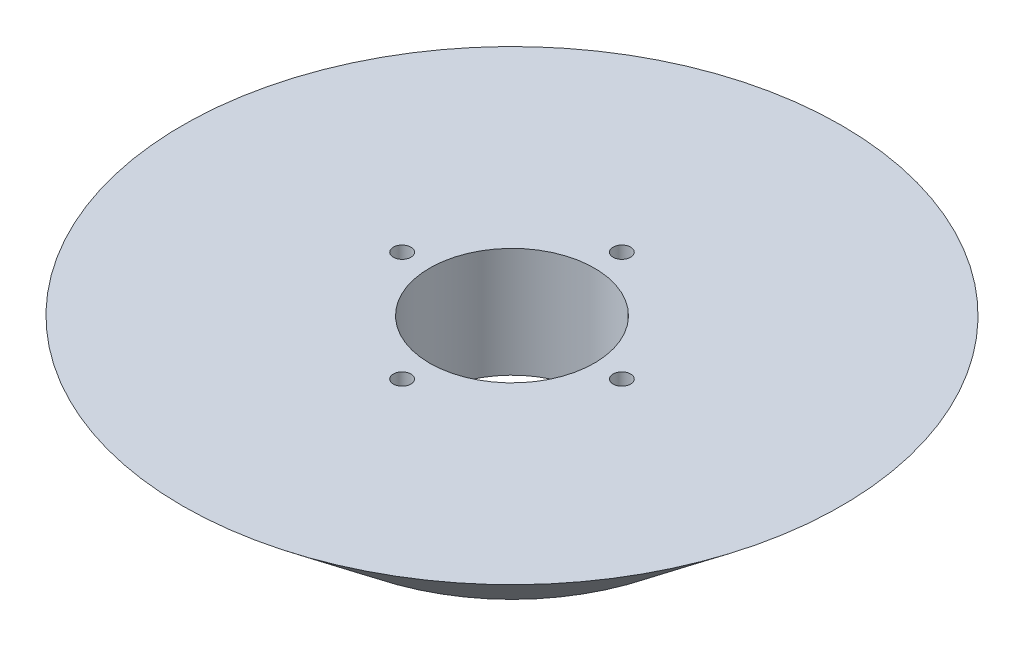
from build123d import *

# Parameters (mm, degrees)
SKETCH_2_R          = 60
SKETCH_1_R          = 35
SKETCH_3_R          = 1.6
SKETCH_3_R_2        = 15
CUT_EXTRUDE_1_DEPTH = 88.177979031


with BuildPart() as part:
    # ｽｹｯﾁ2 → ﾛﾌﾄ1 section 0
    with BuildSketch(Plane(origin=(0, 20, 0), x_dir=(1, 0, 0), z_dir=(0, 1, 0))):
        Circle(SKETCH_2_R)
    # ｽｹｯﾁ1 → ﾛﾌﾄ1 section 1
    with BuildSketch(Plane(origin=(0, 0, 0), x_dir=(1, 0, 0), z_dir=(0, 1, 0))):
        Circle(SKETCH_1_R)
    loft()

    # ｽｹｯﾁ3 → ｶｯﾄ - 押し出し1 (cut, through all)
    with BuildSketch(Plane(origin=(0, 20, 0), x_dir=(1, 0, 0), z_dir=(0, 1, 0))):
        with Locations(Location((0, 20, 0), (0, 0, 270))):
            Circle(SKETCH_3_R)
        with Locations(Location((20, 0, 0), (0, 0, 270))):
            Circle(SKETCH_3_R)
        with Locations(Location((0, -20, 0), (0, 0, 270))):
            Circle(SKETCH_3_R)
        with Locations(Location((-20, 0, 0), (0, 0, 270))):
            Circle(SKETCH_3_R)
        with Locations(Location((0, 0, 0), (0, 0, 270))):
            Circle(SKETCH_3_R_2)
    extrude(amount=-CUT_EXTRUDE_1_DEPTH, mode=Mode.SUBTRACT)


solid = part.part
